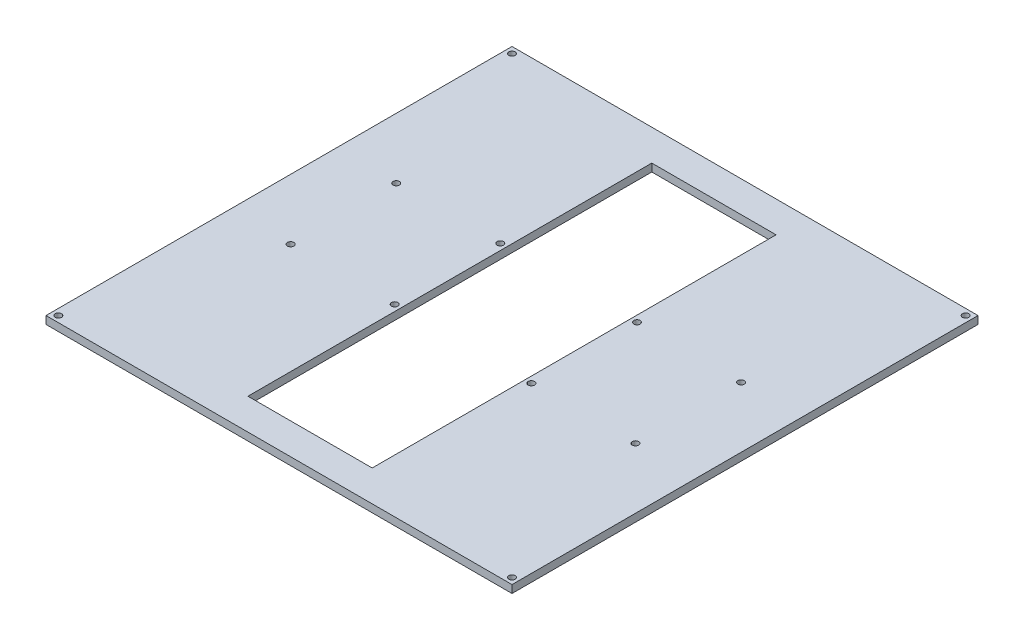
from build123d import *

# Parameters (mm, degrees)
SKETCH1_W                                  = 300
SKETCH1_H                                  = 300
BOSS_EXTRUDE1_DEPTH                        = 5
CUT_EXTRUDE1_REACH                         = 214.191
SKETCH2_R                                  = 2.05
MIRROR1_AT_THE_SECOND_PLANE_COPY_1_REACH   = 214.191
MIRROR1_AT_THE_SECOND_PLANE_COPY_1_SKETC_R = 2.05
CUT_EXTRUDE2_REACH                         = 214.191
SKETCH3_W                                  = 80
SKETCH3_H                                  = 260
CUT_EXTRUDE3_REACH                         = 214.191
SKETCH4_R                                  = 2.05


with BuildPart() as part:
    # Sketch1 → Boss-Extrude1 (new body)
    with BuildSketch(Plane(origin=(0, 0, 0), x_dir=(1, 0, 0), z_dir=(0, 1, 0))):
        Rectangle(SKETCH1_W, SKETCH1_H)
    extrude(amount=BOSS_EXTRUDE1_DEPTH)

    # Sketch2 → Cut-Extrude1 (cut, up to next)
    with BuildSketch(Plane(origin=(0, 5, 0), x_dir=(1, 0, 0), z_dir=(0, 1, 0)), mode=Mode.PRIVATE) as cut_extrude1_sk1:
        with Locations(Location((-146, 146, 0), (0, 0, 270))):
            Circle(SKETCH2_R)
    cut_extrude1_tool1 = extrude(cut_extrude1_sk1.sketch, amount=-CUT_EXTRUDE1_REACH, mode=Mode.PRIVATE) & part.part
    cut_extrude1 = cut_extrude1_tool1.solids().sort_by_distance((-146, 5, -146))[0]
    add(cut_extrude1, mode=Mode.SUBTRACT)

    # Mirror1: Cut-Extrude1 across plane
    add(cut_extrude1.mirror(Plane(origin=(0, 0, 0), x_dir=(0, 0, 1), z_dir=(1, 0, 0))), mode=Mode.SUBTRACT)

    # Mirror1 at the second plane: Cut-Extrude1 across plane
    add(cut_extrude1.mirror(Plane.XY), mode=Mode.SUBTRACT)

    # Mirror1 at the second plane copy 1 sketc → Mirror1 at the second plane copy 1 (cut, up to next)
    with BuildSketch(Plane(origin=(0, 5, 0), x_dir=(-1, 0, 0), z_dir=(0, 1, 0)), mode=Mode.PRIVATE) as mirror1_at_the_second_plane_copy_1_sk1:
        with Locations(Location((-146, 146, 0), (0, 0, 270))):
            Circle(MIRROR1_AT_THE_SECOND_PLANE_COPY_1_SKETC_R)
    mirror1_at_the_second_plane_copy_1_tool1 = extrude(mirror1_at_the_second_plane_copy_1_sk1.sketch, amount=-MIRROR1_AT_THE_SECOND_PLANE_COPY_1_REACH, mode=Mode.PRIVATE) & part.part
    add(mirror1_at_the_second_plane_copy_1_tool1.solids().sort_by_distance((146, 5, 146))[0], mode=Mode.SUBTRACT)

    # Sketch3 → Cut-Extrude2 (cut, up to next)
    with BuildSketch(Plane(origin=(0, 5, 0), x_dir=(1, 0, 0), z_dir=(0, 1, 0)), mode=Mode.PRIVATE) as cut_extrude2_sk1:
        Rectangle(SKETCH3_W, SKETCH3_H)
    cut_extrude2_tool1 = extrude(cut_extrude2_sk1.sketch, amount=-CUT_EXTRUDE2_REACH, mode=Mode.PRIVATE) & part.part
    add(cut_extrude2_tool1.solids().sort_by_distance((0, 5, 0))[0], mode=Mode.SUBTRACT)

    # Sketch4 → Cut-Extrude3 (cut, up to next)
    with BuildSketch(Plane(origin=(0, 5, 0), x_dir=(1, 0, 0), z_dir=(0, 1, 0)), mode=Mode.PRIVATE) as cut_extrude3_sk1:
        with Locations(Location((-111, 36.46851285, 0), (0, 0, 270))):
            Circle(SKETCH4_R)
    cut_extrude3_tool1 = extrude(cut_extrude3_sk1.sketch, amount=-CUT_EXTRUDE3_REACH, mode=Mode.PRIVATE) & part.part
    # Sketch4 → Cut-Extrude3 (cut, up to next)
    with BuildSketch(Plane(origin=(0, 5, 0), x_dir=(1, 0, 0), z_dir=(0, 1, 0)), mode=Mode.PRIVATE) as cut_extrude3_sk2:
        with Locations(Location((-44, 36.46851285, 0), (0, 0, 270))):
            Circle(SKETCH4_R)
    cut_extrude3_tool2 = extrude(cut_extrude3_sk2.sketch, amount=-CUT_EXTRUDE3_REACH, mode=Mode.PRIVATE) & part.part
    # Sketch4 → Cut-Extrude3 (cut, up to next)
    with BuildSketch(Plane(origin=(0, 5, 0), x_dir=(1, 0, 0), z_dir=(0, 1, 0)), mode=Mode.PRIVATE) as cut_extrude3_sk3:
        with Locations(Location((-44, -31.53148715, 0), (0, 0, 270))):
            Circle(SKETCH4_R)
    cut_extrude3_tool3 = extrude(cut_extrude3_sk3.sketch, amount=-CUT_EXTRUDE3_REACH, mode=Mode.PRIVATE) & part.part
    # Sketch4 → Cut-Extrude3 (cut, up to next)
    with BuildSketch(Plane(origin=(0, 5, 0), x_dir=(1, 0, 0), z_dir=(0, 1, 0)), mode=Mode.PRIVATE) as cut_extrude3_sk4:
        with Locations(Location((-111, -31.53148715, 0), (0, 0, 270))):
            Circle(SKETCH4_R)
    cut_extrude3_tool4 = extrude(cut_extrude3_sk4.sketch, amount=-CUT_EXTRUDE3_REACH, mode=Mode.PRIVATE) & part.part
    cut_extrude3_1 = cut_extrude3_tool1.solids().sort_by_distance((-111, 5, -36.468513))[0]
    add(cut_extrude3_1, mode=Mode.SUBTRACT)
    cut_extrude3_2 = cut_extrude3_tool2.solids().sort_by_distance((-44, 5, -36.468513))[0]
    add(cut_extrude3_2, mode=Mode.SUBTRACT)
    cut_extrude3_3 = cut_extrude3_tool3.solids().sort_by_distance((-44, 5, 31.531487))[0]
    add(cut_extrude3_3, mode=Mode.SUBTRACT)
    cut_extrude3_4 = cut_extrude3_tool4.solids().sort_by_distance((-111, 5, 31.531487))[0]
    add(cut_extrude3_4, mode=Mode.SUBTRACT)
    cut_extrude3 = cut_extrude3_1 + cut_extrude3_2 + cut_extrude3_3 + cut_extrude3_4  # Cut-Extrude3 as one shape, for the pattern or mirror that repeats it

    # Mirror2: Cut-Extrude3 across plane
    add(cut_extrude3.mirror(Plane(origin=(0, 0, 0), x_dir=(0, 0, 1), z_dir=(1, 0, 0))), mode=Mode.SUBTRACT)


solid = part.part
